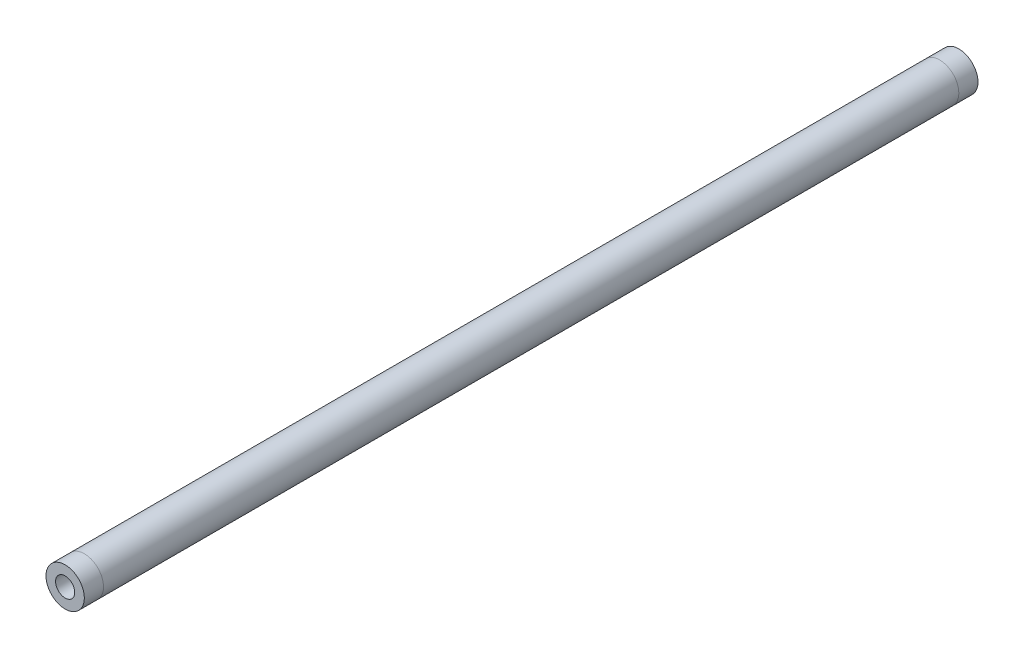
from build123d import *

# Parameters (mm, degrees)
THREADED_START            = -21.9075
SKETCH2_R                 = 6.35
SKETCH2_R_2               = 4.7625
SKETCH2_R_3               = 3.175
THREADED_INSERT_1_1_DEPTH = 6.35
THREADED_START_2          = -28.2575
SKETCH2_5_R               = 4.7625
SKETCH2_5_R_2             = 3.175
THREADED_INSERT_1_2_DEPTH = 6.35
BOSS_EXTRUDE4_START       = -317.701066
SKETCH2_7_R               = 6.35
SKETCH2_7_R_2             = 4.7625
SKETCH2_7_R_3             = 3.175
BOSS_EXTRUDE4_DEPTH       = 6.35
BOSS_EXTRUDE5_START       = -305.001066
SKETCH2_8_R               = 4.7625
SKETCH2_8_R_2             = 3.175
BOSS_EXTRUDE5_DEPTH       = 6.35
BOSS_EXTRUDE6_START       = -28.2575
SKETCH2_9_R               = 6.35
SKETCH2_9_R_2             = 4.7625
BOSS_EXTRUDE6_DEPTH       = 283.0935664


with BuildPart() as part:
    # Sketch2 → Threaded Insert 1-1 (new body)
    # profile 1 of 2: a face of its own
    with BuildSketch(Plane.XY.offset(THREADED_START)):
        Circle(SKETCH2_R)
        Circle(SKETCH2_R_2, mode=Mode.SUBTRACT)
    # profile 2 of 2: a face of its own
    with BuildSketch(Plane.XY.offset(THREADED_START)):
        Circle(SKETCH2_R_2)
        Circle(SKETCH2_R_3, mode=Mode.SUBTRACT)
    extrude(amount=-THREADED_INSERT_1_1_DEPTH)

    # Sketch2<5> → Threaded Insert 1-2 (add)
    with BuildSketch(Plane.XY.offset(THREADED_START_2)):
        Circle(SKETCH2_5_R)
        Circle(SKETCH2_5_R_2, mode=Mode.SUBTRACT)
    extrude(amount=-THREADED_INSERT_1_2_DEPTH)


with BuildPart() as body_2:
    # Sketch2<7> → Boss-Extrude4 (new body)
    # profile 1 of 2: a face of its own
    with BuildSketch(Plane.XY.offset(BOSS_EXTRUDE4_START)):
        Circle(SKETCH2_7_R)
        Circle(SKETCH2_7_R_2, mode=Mode.SUBTRACT)
    # profile 2 of 2: a face of its own
    with BuildSketch(Plane.XY.offset(BOSS_EXTRUDE4_START)):
        Circle(SKETCH2_7_R_2)
        Circle(SKETCH2_7_R_3, mode=Mode.SUBTRACT)
    extrude(amount=BOSS_EXTRUDE4_DEPTH)

    # Sketch2<8> → Boss-Extrude5 (add)
    with BuildSketch(Plane.XY.offset(BOSS_EXTRUDE5_START)):
        Circle(SKETCH2_8_R)
        Circle(SKETCH2_8_R_2, mode=Mode.SUBTRACT)
    extrude(amount=-BOSS_EXTRUDE5_DEPTH)


with BuildPart() as body_3:
    # Sketch2<9> → Boss-Extrude6 (new body)
    with BuildSketch(Plane.XY.offset(BOSS_EXTRUDE6_START)):
        Circle(SKETCH2_9_R)
        Circle(SKETCH2_9_R_2, mode=Mode.SUBTRACT)
    extrude(amount=-BOSS_EXTRUDE6_DEPTH)


solid = Compound([part.part, body_2.part, body_3.part])
